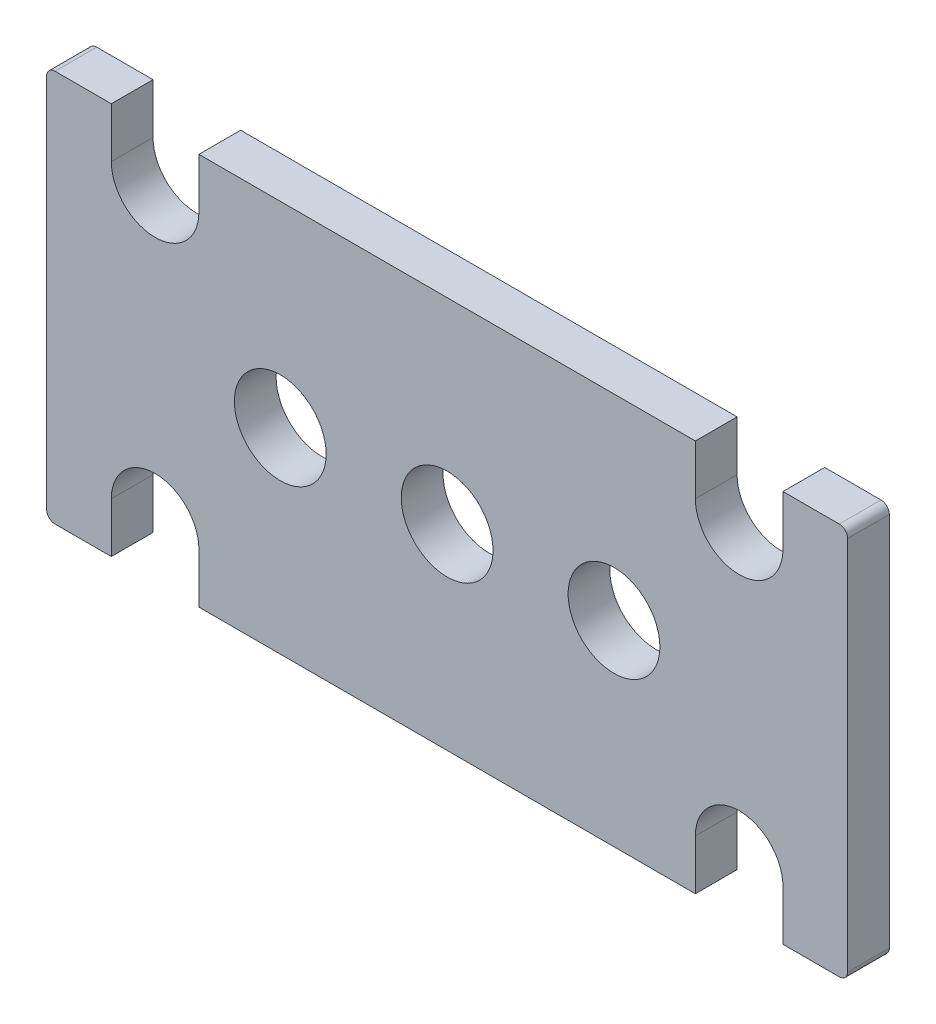
from build123d import *

# Parameters (mm, degrees)
SKETCH_1_W          = 96
SKETCH_1_H          = 47
EXTRUDE_1_DEPTH     = 5
FILLET_1_R          = 1
CUT_EXTRUDE_2_DEPTH = 10
SKETCH_2_R          = 5.25
CUT_EXTRUDE_3_DEPTH = 10


with BuildPart() as part:
    # 草图1 → 凸台-拉伸1 (new body)
    with BuildSketch(Plane.XY):
        with Locations((48, -23.5)):
            Rectangle(SKETCH_1_W, SKETCH_1_H)
    extrude(amount=EXTRUDE_1_DEPTH)

    # 圆角1
    fillet_1_edges = [part.edges().sort_by_distance(p)[0] for p in [
        (0, 0, 2.5),
        (96, 0, 2.5),
        (96, -47, 2.5),
        (0, -47, 2.5),
    ]]
    fillet(fillet_1_edges, radius=FILLET_1_R)

    # 草图8 → 切除-拉伸2 (cut)
    with BuildSketch(Plane.XY.offset(5)):
        with BuildLine():
            ThreePointArc((22.5, -23.5), (28, -29), (33.5, -23.5))
            Line((33.5, -23.5), (22.5, -23.5))
        make_face()
        with BuildLine():
            Line((22.5, -23.5), (33.5, -23.5))
            ThreePointArc((33.5, -23.5), (28, -18), (22.5, -23.5))
        make_face()
        with BuildLine():
            ThreePointArc((42.5, -23.5), (44.110912703, -27.389087297), (48, -29))
            Line((48, -29), (48, -23.5))
            Line((48, -23.5), (42.5, -23.5))
        make_face()
        with BuildLine():
            Line((48, -23.5), (48, -29))
            ThreePointArc((48, -29), (51.889087297, -27.389087297), (53.5, -23.5))
            Line((53.5, -23.5), (48, -23.5))
        make_face()
        with BuildLine():
            Line((42.5, -23.5), (48, -23.5))
            Line((48, -23.5), (48, -18))
            ThreePointArc((48, -18), (44.110912703, -19.610912703), (42.5, -23.5))
        make_face()
        with BuildLine():
            Line((48, -18), (48, -23.5))
            Line((48, -23.5), (53.5, -23.5))
            ThreePointArc((53.5, -23.5), (51.889087297, -19.610912703), (48, -18))
        make_face()
        with BuildLine():
            ThreePointArc((73.5, -23.5), (68, -18), (62.5, -23.5))
            Line((62.5, -23.5), (73.5, -23.5))
        make_face()
        with BuildLine():
            Line((73.5, -23.5), (62.5, -23.5))
            ThreePointArc((62.5, -23.5), (68, -29), (73.5, -23.5))
        make_face()
    extrude(amount=-CUT_EXTRUDE_2_DEPTH, mode=Mode.SUBTRACT)

    # 草图2 → 切除-拉伸3 (cut)
    with BuildSketch(Plane.XY.offset(5)):
        with Locations((83, -6)):
            Circle(SKETCH_2_R)
        with Locations((13, -6)):
            Circle(SKETCH_2_R)
        with Locations((13, -41)):
            Circle(SKETCH_2_R)
        with Locations((83, -41)):
            Circle(SKETCH_2_R)
        with BuildLine():
            Line((18.25, -6), (18.25, 0))
            Line((18.25, 0), (7.75, 0))
            Line((7.75, 0), (7.75, -6))
            ThreePointArc((7.75, -6), (13, -0.75), (18.25, -6))
        make_face()
        with BuildLine():
            Line((7.75, -47), (18.25, -47))
            Line((18.25, -47), (18.25, -41))
            ThreePointArc((18.25, -41), (13, -46.25), (7.75, -41))
            Line((7.75, -41), (7.75, -47))
        make_face()
        with BuildLine():
            Line((77.75, -41), (77.75, -47))
            Line((77.75, -47), (88.25, -47))
            Line((88.25, -47), (88.25, -41))
            ThreePointArc((88.25, -41), (83, -46.25), (77.75, -41))
        make_face()
        with BuildLine():
            Line((88.25, 0), (77.75, 0))
            Line((77.75, 0), (77.75, -6))
            ThreePointArc((77.75, -6), (83, -0.75), (88.25, -6))
            Line((88.25, -6), (88.25, 0))
        make_face()
    extrude(amount=-CUT_EXTRUDE_3_DEPTH, mode=Mode.SUBTRACT)


solid = part.part
